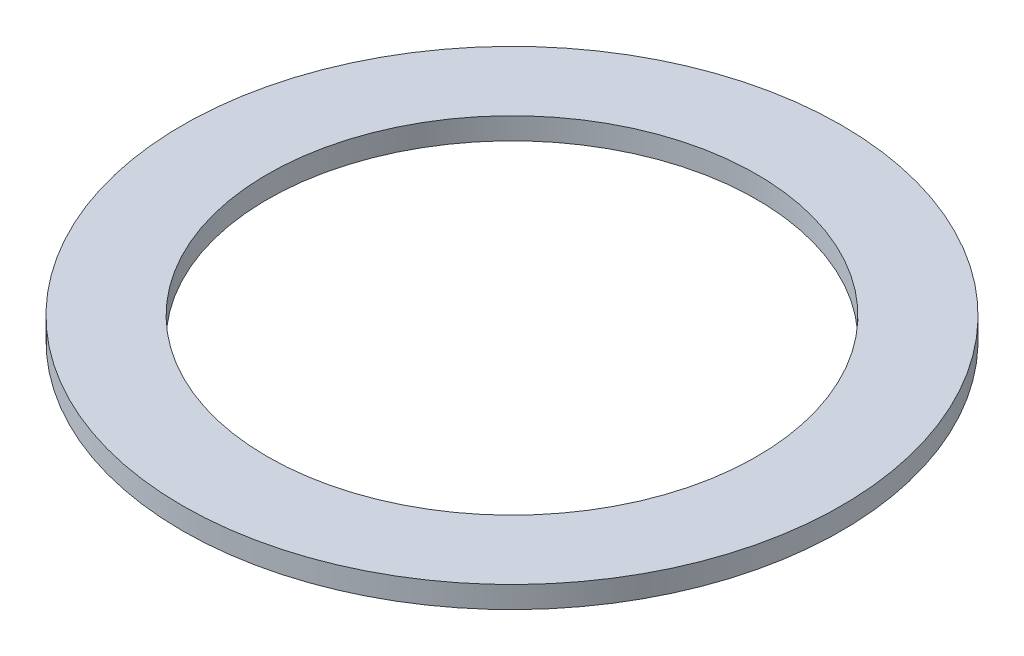
from build123d import *

# Parameters (mm, degrees)
SKETCH_1_R      = 60.625
SKETCH_1_R_2    = 45
EXTRUDE_1_DEPTH = 4


with BuildPart() as part:
    # 草图1 → 凸台-拉伸1 (new body)
    with BuildSketch(Plane(origin=(0, 0, 0), x_dir=(1, 0, 0), z_dir=(0, 1, 0))):
        with Locations(Location((0, 0, 0), (0, 0, 270))):
            Circle(SKETCH_1_R)
        with Locations(Location((0, 0, 0), (0, 0, 270))):
            Circle(SKETCH_1_R_2, mode=Mode.SUBTRACT)
    extrude(amount=EXTRUDE_1_DEPTH)


solid = part.part
